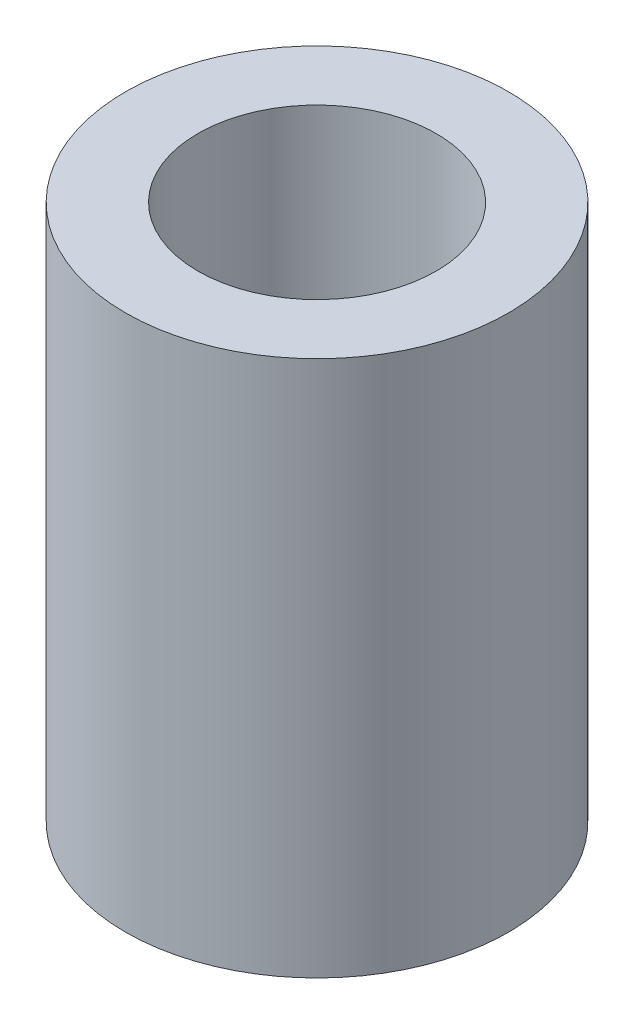
from build123d import *

# Parameters (mm, degrees)
SKETCH_1_R          = 2.25
EXTRUDE_1_DEPTH     = 6.3
SKETCH_2_R          = 1.4
CUT_EXTRUDE_2_DEPTH = 3.3


with BuildPart() as part:
    # 草图1 → 拉伸1 (new body)
    with BuildSketch(Plane(origin=(0, 0, 0), x_dir=(1, 0, 0), z_dir=(0, 1, 0))):
        with Locations(Location((0, 0, 0), (0, 0, 270))):
            Circle(SKETCH_1_R)
    extrude(amount=EXTRUDE_1_DEPTH)

    # 草图2 → 拉伸2 (cut)
    with BuildSketch(Plane(origin=(0, 6.3, 0), x_dir=(1, 0, 0), z_dir=(0, 1, 0))):
        with Locations(Location((0, 0, 0), (0, 0, 270))):
            Circle(SKETCH_2_R)
    extrude(amount=-CUT_EXTRUDE_2_DEPTH, mode=Mode.SUBTRACT)


solid = part.part
